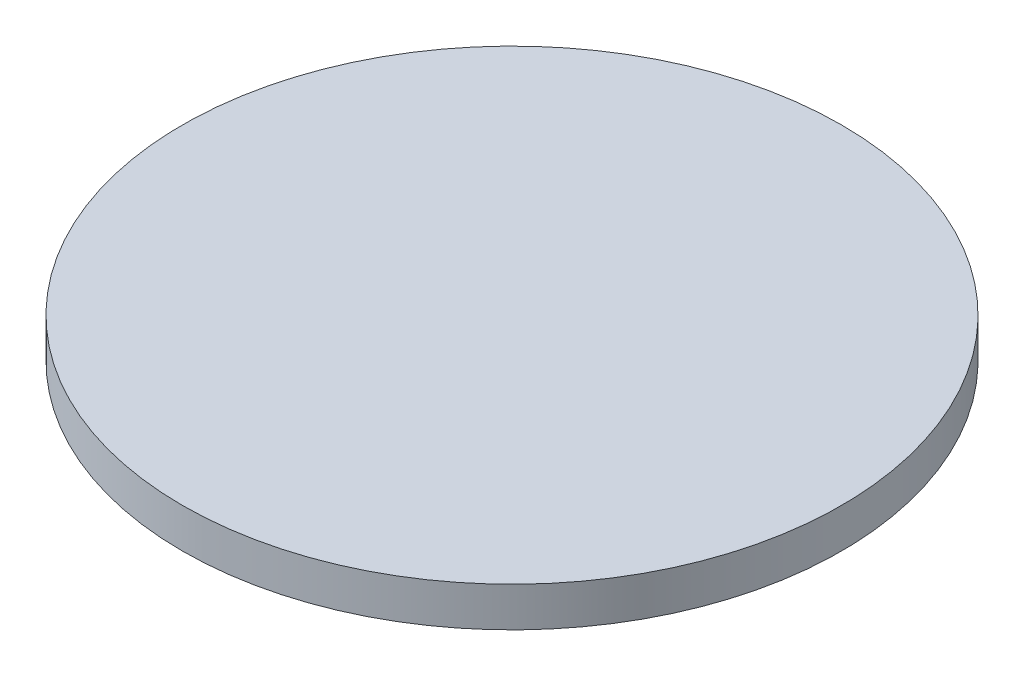
from build123d import *

# Parameters (mm, degrees)
SKETCH1_R           = 12.5
BOSS_EXTRUDE1_DEPTH = 1.5


with BuildPart() as part:
    # Sketch1 → Boss-Extrude1 (new body)
    with BuildSketch(Plane(origin=(0, 0, 0), x_dir=(1, 0, 0), z_dir=(0, 1, 0))):
        with Locations(Location((0, 0, 0), (0, 0, 270))):
            Circle(SKETCH1_R)
    extrude(amount=BOSS_EXTRUDE1_DEPTH)


solid = part.part
